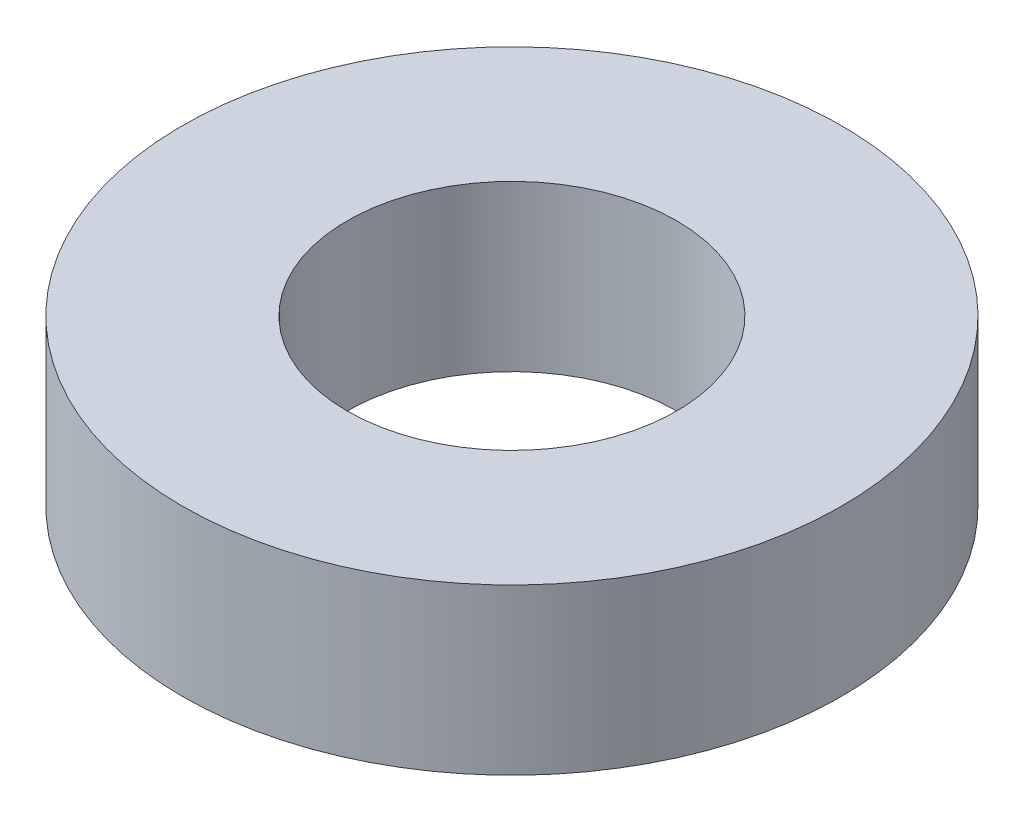
from build123d import *

# Parameters (mm, degrees)
SKETCH1_R           = 4
SKETCH1_R_2         = 2
BOSS_EXTRUDE1_DEPTH = 1


with BuildPart() as part:
    # Sketch1 → Boss-Extrude1 (new, symmetric)
    with BuildSketch(Plane(origin=(0, 0, 0), x_dir=(1, 0, 0), z_dir=(0, 1, 0))):
        with Locations(Location((0, 0, 0), (0, 0, 270))):
            Circle(SKETCH1_R)
        with Locations(Location((0, 0, 0), (0, 0, 270))):
            Circle(SKETCH1_R_2, mode=Mode.SUBTRACT)
    extrude(amount=BOSS_EXTRUDE1_DEPTH, both=True)


solid = part.part
